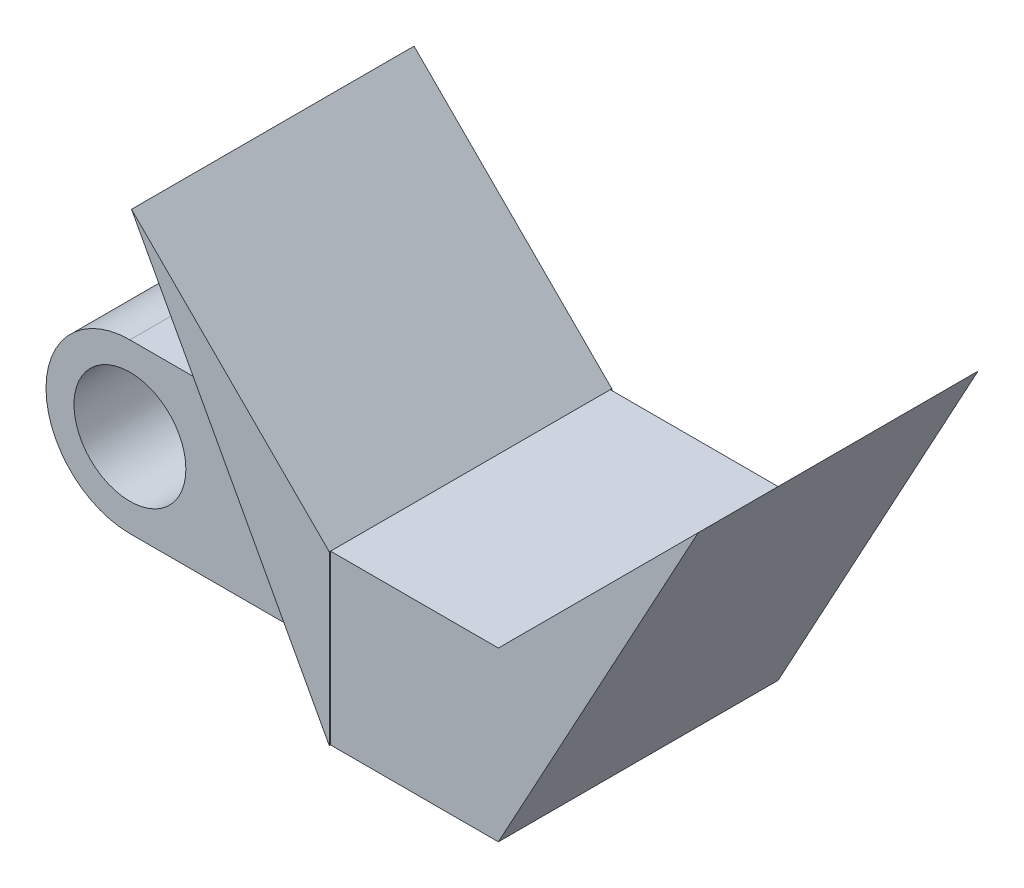
from build123d import *

# Parameters (mm, degrees)
CROQUIS1_R                    = 5
SALIENTE_EXTRUIR1_DEPTH       = 10
CROQUIS4_W                    = 15
CROQUIS4_H                    = 25
SALIENTE_EXTRUIR3_DEPTH       = 15
SALIENTE_EXTRUIR9_DEPTH       = 25
SALIENTE_EXTRUIR10_DEPTH      = 7.75
SALIENTE_EXTRUIR10_DEPTH_BACK = 17.5
ESCALA1_SCALE                 = 0.75


with BuildPart() as part:
    # Croquis1 → Saliente-Extruir1 (new body)
    with BuildSketch(Plane.XY):
        with BuildLine():
            Line((0, 7.5), (30, 7.5))
            Line((30, 7.5), (37.5, 7.5))
            Line((37.5, 7.5), (37.5, -7.5))
            Line((37.5, -7.5), (30, -7.5))
            Line((30, -7.5), (0, -7.5))
            ThreePointArc((0, -7.5), (-7.5, 0), (0, 7.5))
        make_face()
        Circle(CROQUIS1_R, mode=Mode.SUBTRACT)
    extrude(amount=SALIENTE_EXTRUIR1_DEPTH)

    # Croquis4 → Saliente-Extruir3 (add)
    with BuildSketch(Plane.XZ.offset(7.5)):
        with Locations((32.819126762, 4.89)):
            Rectangle(CROQUIS4_W, CROQUIS4_H)
    extrude(amount=-SALIENTE_EXTRUIR3_DEPTH)

    # Croquis11 → Saliente-Extruir9 (add)
    with BuildSketch(Plane(origin=(0, 0, -7.61), x_dir=(-1, 0, 0), z_dir=(0, 0, -1))):
        Polygon((-40.319126762, 7.5), (-58.184981349, 25.365854587), (-40.319126762, -7.5), align=None)
    extrude(amount=-SALIENTE_EXTRUIR9_DEPTH)

    # Croquis14 → Saliente-Extruir10 (add, two sides: drawn at the far end of the back side and taken through both)
    with BuildSketch(Plane(origin=(0, 0, 0), x_dir=(-1, 0, 0), z_dir=(0, 0, -1)).offset(-SALIENTE_EXTRUIR10_DEPTH_BACK)):
        Polygon((-25.319126762, 7.5), (-7.641457232, 25.17766953), (-25.319126762, -7.5), align=None)
    extrude(amount=SALIENTE_EXTRUIR10_DEPTH + SALIENTE_EXTRUIR10_DEPTH_BACK)


with BuildPart() as part_1:
    # Escala1: scaled about (27.940941058, 3.516863711, 4.909948999)
    add(part.part.scale(ESCALA1_SCALE).moved(Location((6.985235264, 0.879215928, 1.22748725))))


solid = part_1.part
